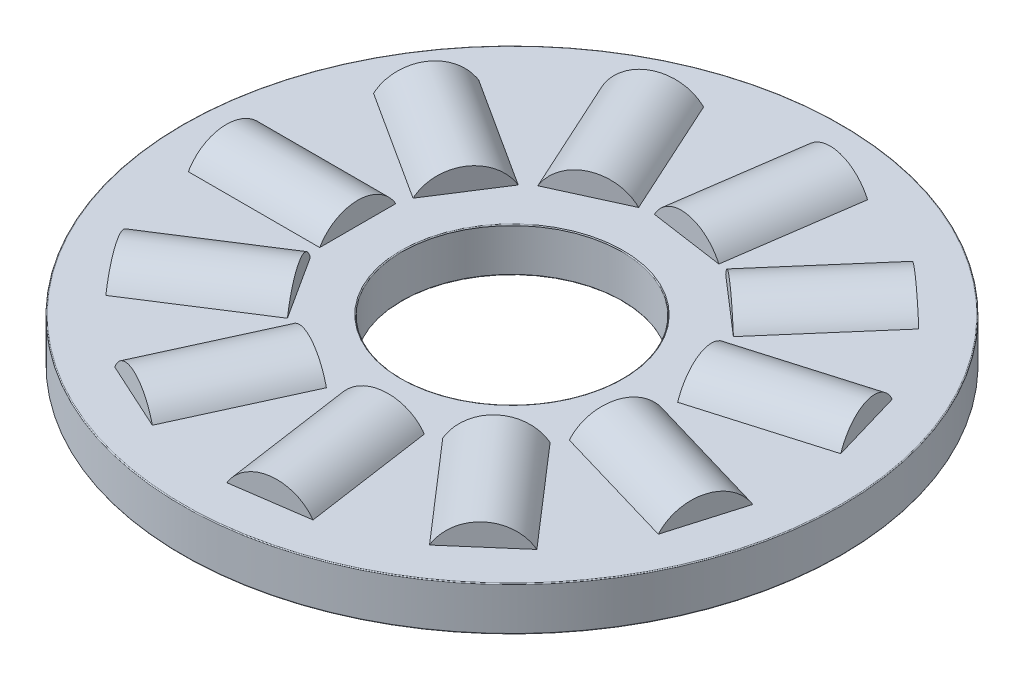
from build123d import *

# Parameters (mm, degrees)
SKETCH4_W         = 2.99
SKETCH4_H         = 1
SKETCH5_W         = 2.99
SKETCH5_H         = 1
CIRPATTERN2_COUNT = 11
CIRPATTERN3_COUNT = 11


with BuildPart() as part:
    # Sketch3 → Revolve1 (revolve)
    with BuildSketch(Plane.XY):
        with BuildLine():
            Line((-7.48, 0.5), (-2.53, 0.5))
            ThreePointArc((-2.53, 0.5), (-2.515857864, 0.494142136), (-2.51, 0.48))
            Line((-2.51, 0.48), (-2.51, -0.48))
            ThreePointArc((-2.51, -0.48), (-2.515857864, -0.494142136), (-2.53, -0.5))
            Line((-2.53, -0.5), (-7.48, -0.5))
            ThreePointArc((-7.48, -0.5), (-7.494142136, -0.494142136), (-7.5, -0.48))
            Line((-7.5, -0.48), (-7.5, 0.48))
            ThreePointArc((-7.5, 0.48), (-7.494142136, 0.494142136), (-7.48, 0.5))
        make_face()
    revolve(axis=Axis((0, 0.5, 0), (0, -1, 0)))

    # Sketch4 → Cut-Revolve1 (revolve, cut)
    with BuildSketch(Plane.XY):
        with Locations((-5.005, 0.5)):
            Rectangle(SKETCH4_W, SKETCH4_H)
    cut_revolve1 = revolve(axis=Axis((-6.5, 0, 0), (1, 0, 0)), mode=Mode.SUBTRACT)

    # CirPattern2: Cut-Revolve1 ×11 about axis
    cirpattern2_axis = Axis((0, 0.5, 0), (0, -1, 0))
    for i in range(1, CIRPATTERN2_COUNT):
        add(cut_revolve1.rotate(cirpattern2_axis, i * 360 / CIRPATTERN2_COUNT), mode=Mode.SUBTRACT)


with BuildPart() as body_2:
    # Sketch5 → Revolve2 (revolve)
    with BuildSketch(Plane.XY):
        with Locations((-5.005, 0.5)):
            Rectangle(SKETCH5_W, SKETCH5_H)
    revolve(axis=Axis((-3.51, 0, 0), (-1, 0, 0)))


with BuildPart() as cirpattern3_1:
    # CirPattern3: pattern copy
    add(body_2.part.rotate(Axis((0, 0.5, 0), (0, -1, 0)), 1 * 360 / CIRPATTERN3_COUNT))


with BuildPart() as cirpattern3_2:
    # CirPattern3: pattern copy
    add(body_2.part.rotate(Axis((0, 0.5, 0), (0, -1, 0)), 2 * 360 / CIRPATTERN3_COUNT))


with BuildPart() as cirpattern3_3:
    # CirPattern3: pattern copy
    add(body_2.part.rotate(Axis((0, 0.5, 0), (0, -1, 0)), 3 * 360 / CIRPATTERN3_COUNT))


with BuildPart() as cirpattern3_4:
    # CirPattern3: pattern copy
    add(body_2.part.rotate(Axis((0, 0.5, 0), (0, -1, 0)), 4 * 360 / CIRPATTERN3_COUNT))


with BuildPart() as cirpattern3_5:
    # CirPattern3: pattern copy
    add(body_2.part.rotate(Axis((0, 0.5, 0), (0, -1, 0)), 5 * 360 / CIRPATTERN3_COUNT))


with BuildPart() as cirpattern3_6:
    # CirPattern3: pattern copy
    add(body_2.part.rotate(Axis((0, 0.5, 0), (0, -1, 0)), 6 * 360 / CIRPATTERN3_COUNT))


with BuildPart() as cirpattern3_7:
    # CirPattern3: pattern copy
    add(body_2.part.rotate(Axis((0, 0.5, 0), (0, -1, 0)), 7 * 360 / CIRPATTERN3_COUNT))


with BuildPart() as cirpattern3_8:
    # CirPattern3: pattern copy
    add(body_2.part.rotate(Axis((0, 0.5, 0), (0, -1, 0)), 8 * 360 / CIRPATTERN3_COUNT))


with BuildPart() as cirpattern3_9:
    # CirPattern3: pattern copy
    add(body_2.part.rotate(Axis((0, 0.5, 0), (0, -1, 0)), 9 * 360 / CIRPATTERN3_COUNT))


with BuildPart() as cirpattern3_10:
    # CirPattern3: pattern copy
    add(body_2.part.rotate(Axis((0, 0.5, 0), (0, -1, 0)), 10 * 360 / CIRPATTERN3_COUNT))


solid = Compound([part.part, body_2.part, cirpattern3_1.part, cirpattern3_2.part, cirpattern3_3.part, cirpattern3_4.part, cirpattern3_5.part, cirpattern3_6.part, cirpattern3_7.part, cirpattern3_8.part, cirpattern3_9.part, cirpattern3_10.part])
